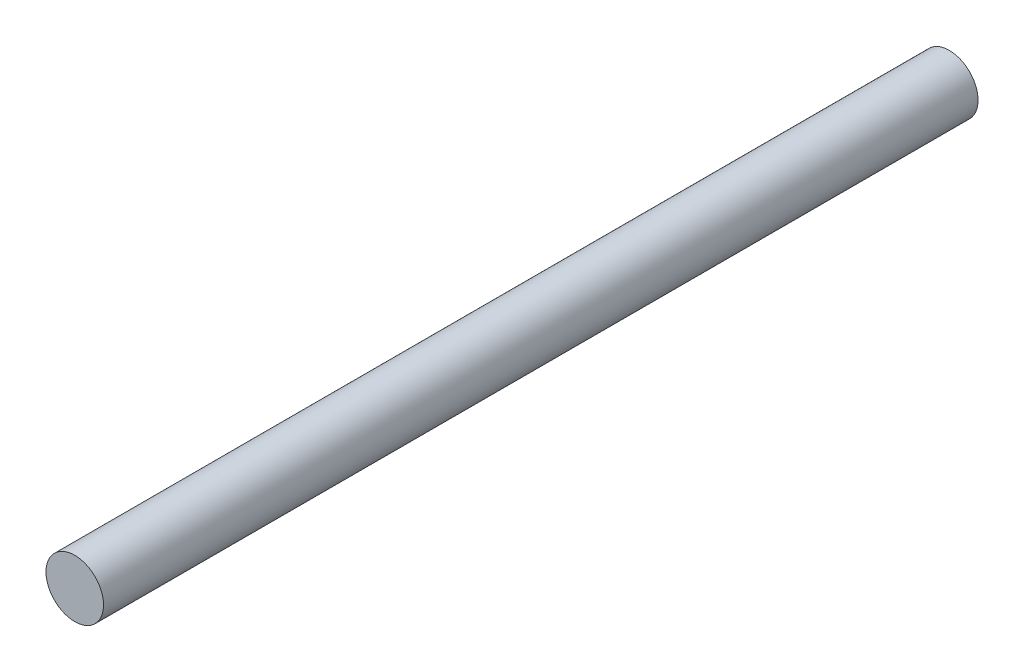
from build123d import *

# Parameters (mm, degrees)
SKETCH1_R           = 1.5875
BOSS_EXTRUDE1_DEPTH = 48.26


with BuildPart() as part:
    # Sketch1 → Boss-Extrude1 (new body)
    with BuildSketch(Plane.XY):
        with Locations(Location((0, 0, 0), (0, 0, 180))):
            Circle(SKETCH1_R)
    extrude(amount=BOSS_EXTRUDE1_DEPTH)


solid = part.part
